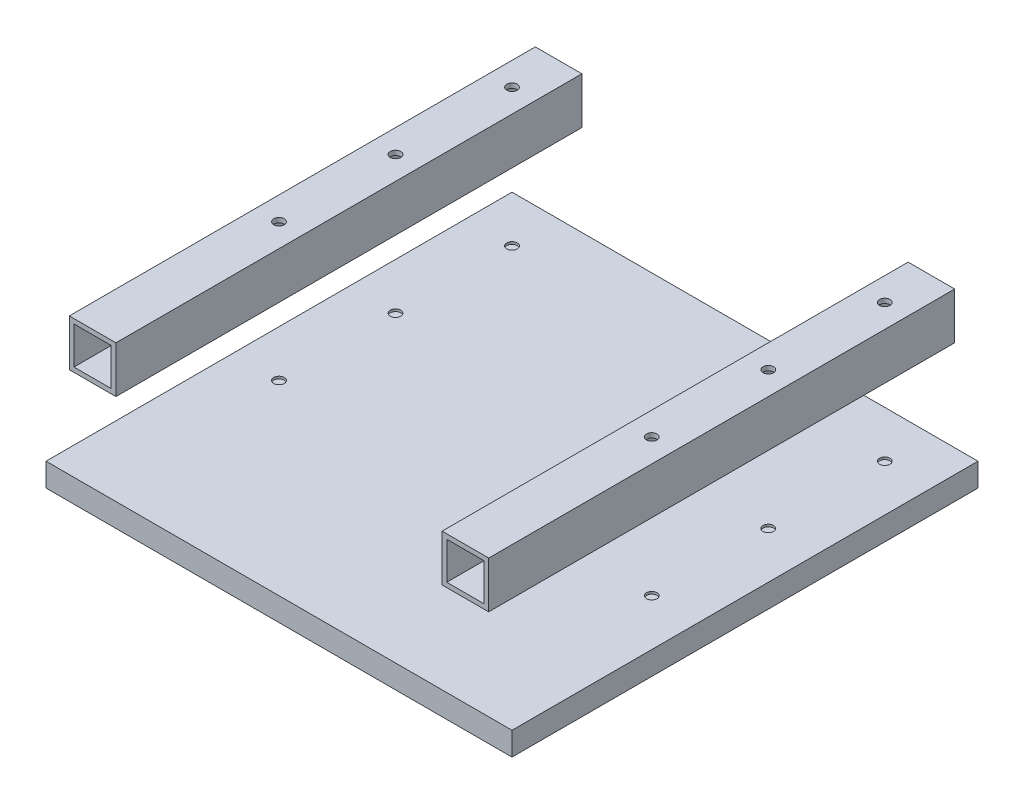
from build123d import *

# Parameters (mm, degrees)
SKETCH_1_W          = 200
SKETCH_1_H          = 10
EXTRUDE_1_DEPTH     = 100
SKETCH_1_W_2        = 20
SKETCH_1_H_2        = 20
SKETCH_1_W_3        = 16
SKETCH_1_H_3        = 16
EXTRUDE_1_2_DEPTH   = 100
EXTRUDE_1_3_DEPTH   = 100
SKETCH_2_R          = 2.25
CUT_EXTRUDE_1_DEPTH = 20
SKETCH_3_R          = 2.25
CUT_EXTRUDE_6_DEPTH = 60


with BuildPart() as part:
    # 草图1 → 凸台-拉伸1 (new, symmetric)
    with BuildSketch(Plane.XY):
        with Locations((0, -44)):
            Rectangle(SKETCH_1_W, SKETCH_1_H)
    extrude(amount=EXTRUDE_1_DEPTH, both=True)

    # 草图3 → 切除-拉伸6 (cut)
    with BuildSketch(Plane(origin=(0, 20, 0), x_dir=(1, 0, 0), z_dir=(0, 1, 0))):
        with Locations(Location((80, -20, 0), (0, 0, 270))):
            Circle(SKETCH_3_R)
        with Locations(Location((80, 30, 0), (0, 0, 270))):
            Circle(SKETCH_3_R)
        with Locations(Location((80, 80, 0), (0, 0, 270))):
            Circle(SKETCH_3_R)
        with Locations(Location((-80, -20, 0), (0, 0, 270))):
            Circle(SKETCH_3_R)
        with Locations(Location((-80, 30, 0), (0, 0, 270))):
            Circle(SKETCH_3_R)
        with Locations(Location((-80, 80, 0), (0, 0, 270))):
            Circle(SKETCH_3_R)
    extrude(amount=-CUT_EXTRUDE_6_DEPTH, mode=Mode.SUBTRACT)


with BuildPart() as body_2:
    # 草图1 → Extrude 1 2 (new, symmetric)
    with BuildSketch(Plane.XY):
        with Locations((-80, 10)):
            Rectangle(SKETCH_1_W_2, SKETCH_1_H_2)
        with Locations((-80, 10)):
            Rectangle(SKETCH_1_W_3, SKETCH_1_H_3, mode=Mode.SUBTRACT)
    extrude(amount=EXTRUDE_1_2_DEPTH, both=True)


with BuildPart() as body_3:
    # 草图1 → Extrude 1 3 (new, symmetric)
    with BuildSketch(Plane.XY):
        with Locations((80, 10)):
            Rectangle(SKETCH_1_W_2, SKETCH_1_H_2)
        with Locations((80, 10)):
            Rectangle(SKETCH_1_W_3, SKETCH_1_H_3, mode=Mode.SUBTRACT)
    extrude(amount=EXTRUDE_1_3_DEPTH, both=True)


with BuildPart() as cut_extrude_1_tool:
    # 草图2 → 切除-拉伸1 (new body)
    with BuildSketch(Plane(origin=(0, 20, 0), x_dir=(1, 0, 0), z_dir=(0, 1, 0))):
        with Locations(Location((80, 80, 0), (0, 0, 270))):
            Circle(SKETCH_2_R)
        with Locations(Location((80, 30, 0), (0, 0, 270))):
            Circle(SKETCH_2_R)
        with Locations(Location((80, -20, 0), (0, 0, 270))):
            Circle(SKETCH_2_R)
        with Locations(Location((-80, -20, 0), (0, 0, 270))):
            Circle(SKETCH_2_R)
        with Locations(Location((-80, 30, 0), (0, 0, 270))):
            Circle(SKETCH_2_R)
        with Locations(Location((-80, 80, 0), (0, 0, 270))):
            Circle(SKETCH_2_R)
    extrude(amount=-CUT_EXTRUDE_1_DEPTH)


with BuildPart() as body_2_1:
    add(body_2.part)

    # 切除-拉伸1: cut by cut_extrude_1_tool
    add(cut_extrude_1_tool.part, mode=Mode.SUBTRACT)


with BuildPart() as body_3_1:
    add(body_3.part)

    # 切除-拉伸1: cut by cut_extrude_1_tool
    add(cut_extrude_1_tool.part, mode=Mode.SUBTRACT)


solid = Compound([part.part, body_2_1.part, body_3_1.part])
